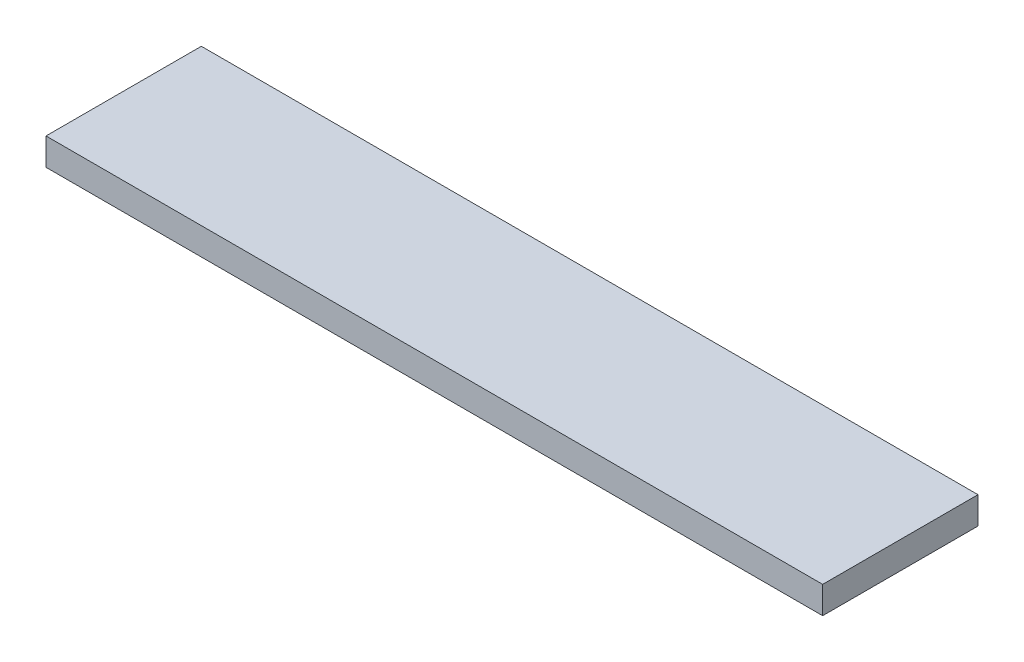
from build123d import *

# Parameters (mm, degrees)
SKETCH1_W           = 40
SKETCH1_H           = 7
BOSS_EXTRUDE1_DEPTH = 200


with BuildPart() as part:
    # Sketch1 → Boss-Extrude1 (new body)
    with BuildSketch(Plane(origin=(0, 0, 0), x_dir=(0, 0, -1), z_dir=(1, 0, 0))):
        Rectangle(SKETCH1_W, SKETCH1_H)
    extrude(amount=BOSS_EXTRUDE1_DEPTH)


solid = part.part
